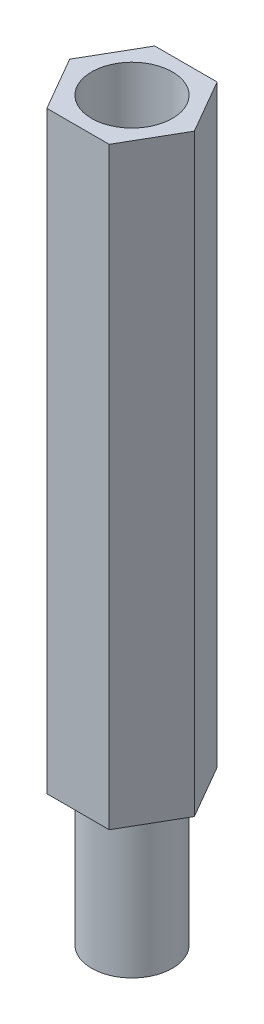
from build123d import *

# Parameters (mm, degrees)
EXTRUDE_1_DEPTH     = 25
SKETCH_2_R          = 1.7
EXTRUDE_2_DEPTH     = 6
SKETCH_3_R          = 1.7
CUT_EXTRUDE_1_DEPTH = 4


with BuildPart() as part:
    # 草图1 → 凸台-拉伸1 (new body)
    with BuildSketch(Plane(origin=(0, 0, 0), x_dir=(1, 0, 0), z_dir=(0, 1, 0))):
        Polygon((1.3125, -2.273316685), (2.625, 0), (1.3125, 2.273316685), (-1.3125, 2.273316685), (-2.625, 0), (-1.3125, -2.273316685), align=None)
    extrude(amount=EXTRUDE_1_DEPTH)

    # 草图2 → 凸台-拉伸2 (add)
    with BuildSketch(Plane(origin=(0, 0, 0), x_dir=(1, 0, 0), z_dir=(0, 1, 0))):
        with Locations(Location((0, 0, 0), (0, 0, 270))):
            Circle(SKETCH_2_R)
    extrude(amount=-EXTRUDE_2_DEPTH)

    # 草图3 → 切除-拉伸1 (cut)
    with BuildSketch(Plane(origin=(0, 25, 0), x_dir=(1, 0, 0), z_dir=(0, 1, 0))):
        with Locations(Location((0, 0, 0), (0, 0, 270))):
            Circle(SKETCH_3_R)
    extrude(amount=-CUT_EXTRUDE_1_DEPTH, mode=Mode.SUBTRACT)


solid = part.part
